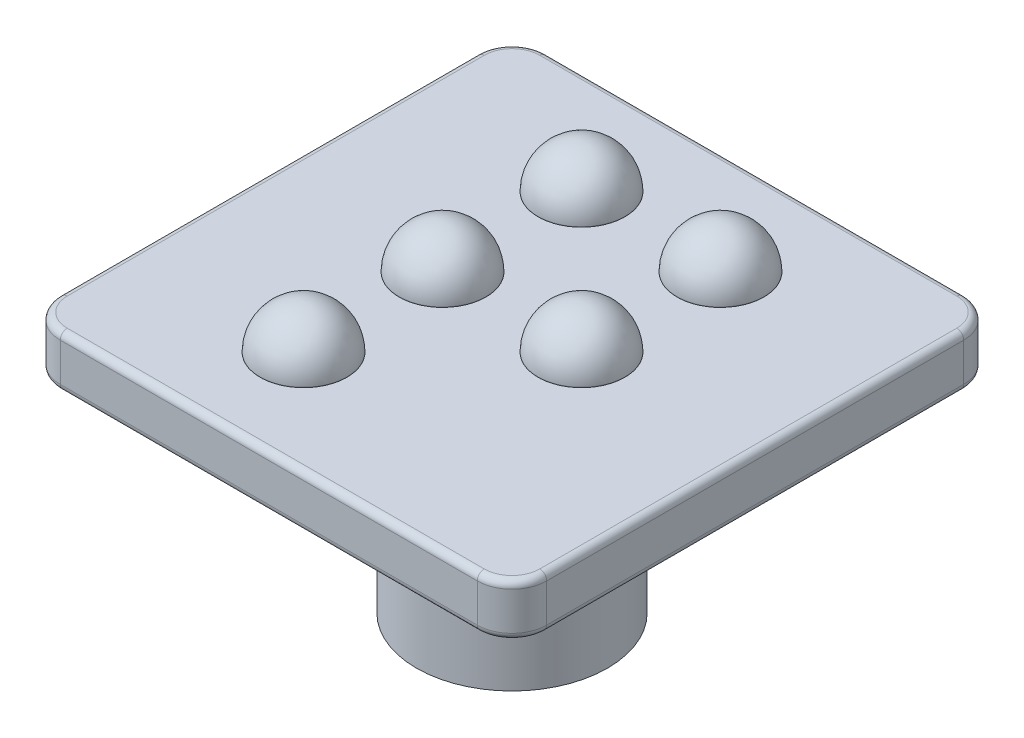
from build123d import *

# Parameters (mm, degrees)
BOSS_EXTRUDE1_DEPTH = 1.5
SKETCH2_R           = 2.75
BOSS_EXTRUDE2_DEPTH = 6
SKETCH3_W           = 1.1
SKETCH3_H           = 1.45
SKETCH3_W_2         = 1.45
SKETCH3_H_2         = 1.1
CUT_EXTRUDE1_DEPTH  = 6
CHAMFER1_SIZE       = 0.3
FILLET1_R           = 1
SKETCH4_R           = 1.25
BOSS_EXTRUDE3_DEPTH = 0.01
DOME1_FACE_RADIUS   = 1.25
DOME1_HEIGHT        = 1.25
DOME2_FACE_RADIUS   = 1.25
DOME2_HEIGHT        = 1.25
DOME3_FACE_RADIUS   = 1.25
DOME3_HEIGHT        = 1.25
DOME4_FACE_RADIUS   = 1.25
DOME4_HEIGHT        = 1.25
DOME5_FACE_RADIUS   = 1.25
DOME5_HEIGHT        = 1.25
FILLET3_R           = 0.2


with BuildPart() as part:
    # Sketch1 → Boss-Extrude1 (new body)
    with BuildSketch(Plane(origin=(0, 0, 0), x_dir=(1, 0, 0), z_dir=(0, 1, 0))):
        with BuildLine():
            Line((-7.324675649, 4.396717546), (4.675324351, 4.396717546))
            ThreePointArc((4.675324351, 4.396717546), (5.382431132, 4.103824327), (5.675324351, 3.396717546))
            Line((5.675324351, 3.396717546), (5.675324351, -8.603282454))
            ThreePointArc((5.675324351, -8.603282454), (5.382431132, -9.310389235), (4.675324351, -9.603282454))
            Line((4.675324351, -9.603282454), (-7.324675649, -9.603282454))
            ThreePointArc((-7.324675649, -9.603282454), (-8.03178243, -9.310389235), (-8.324675649, -8.603282454))
            Line((-8.324675649, -8.603282454), (-8.324675649, 3.396717546))
            ThreePointArc((-8.324675649, 3.396717546), (-8.03178243, 4.103824327), (-7.324675649, 4.396717546))
        make_face()
    extrude(amount=BOSS_EXTRUDE1_DEPTH)

    # Sketch2 → Boss-Extrude2 (add)
    with BuildSketch(Plane.XZ):
        with Locations(Location((-1.324675649, 2.603282454, 0), (0, 0, 270))):
            Circle(SKETCH2_R)
    extrude(amount=BOSS_EXTRUDE2_DEPTH)

    # Sketch3 → Cut-Extrude1 (cut)
    with BuildSketch(Plane.XZ.offset(6)):
        with Locations((-1.324675649, 3.878282454)):
            Rectangle(SKETCH3_W, SKETCH3_H)
        with Locations((-0.049675649, 2.603282454)):
            Rectangle(SKETCH3_W_2, SKETCH3_H_2)
        with Locations((-1.324675649, 2.603282454)):
            Rectangle(SKETCH3_W, SKETCH3_H_2)
        with Locations((-2.599675649, 2.603282454)):
            Rectangle(SKETCH3_W_2, SKETCH3_H_2)
        with Locations((-1.324675649, 1.328282454)):
            Rectangle(SKETCH3_W, SKETCH3_H)
    extrude(amount=-CUT_EXTRUDE1_DEPTH, mode=Mode.SUBTRACT)

    # Chamfer1
    chamfer1_edges = [part.edges().sort_by_distance(p)[0] for p in [
        (-0.774675649, -6, 3.878282454),
        (-0.049675649, -6, 3.153282454),
        (0.675324351, -6, 2.603282454),
        (-0.774675649, -6, 1.328282454),
        (-2.599675649, -6, 3.153282454),
        (-1.324675649, -6, 4.603282454),
        (-1.874675649, -6, 3.878282454),
        (-3.324675649, -6, 2.603282454),
        (-2.599675649, -6, 2.053282454),
        (-1.874675649, -6, 1.328282454),
        (-1.324675649, -6, 0.603282454),
        (-0.049675649, -6, 2.053282454),
    ]]
    chamfer(chamfer1_edges, length=CHAMFER1_SIZE)

    # Fillet1
    fillet1_edges = [part.edges().sort_by_distance(p)[0] for p in [
        (-1.324675649, 0, 5.353282454),
    ]]
    fillet(fillet1_edges, radius=FILLET1_R)

    # Sketch4 → Boss-Extrude3 (add)
    with BuildSketch(Plane(origin=(0, 1.5, 0), x_dir=(1, 0, 0), z_dir=(0, 1, 0))):
        with Locations(Location((-3.324675649, 1.396717546, 0), (0, 0, 90))):
            Circle(SKETCH4_R)
        with Locations(Location((0.675324351, -2.603282454, 0), (0, 0, 90))):
            Circle(SKETCH4_R)
        with Locations(Location((-3.324675649, -2.603282454, 0), (0, 0, 90))):
            Circle(SKETCH4_R)
        with Locations(Location((-3.324675649, -6.603282454, 0), (0, 0, 90))):
            Circle(SKETCH4_R)
        with Locations(Location((0.675324351, 1.396717546, 0), (0, 0, 90))):
            Circle(SKETCH4_R)
    extrude(amount=BOSS_EXTRUDE3_DEPTH)

    # Dome1: a dome of height H over a round flat face of radius A is a cap of a sphere of radius (A * A + H * H) / (2 * H)
    dome1_r = (DOME1_FACE_RADIUS * DOME1_FACE_RADIUS + DOME1_HEIGHT * DOME1_HEIGHT) / (2 * DOME1_HEIGHT)
    dome1_base = Plane((-3.324675649, 1.51, -1.396717546), z_dir=(0, 1, 0))
    with Locations(dome1_base.offset(DOME1_HEIGHT - dome1_r)):
        dome1_ball = Sphere(dome1_r, mode=Mode.PRIVATE)
    add(split(dome1_ball, bisect_by=dome1_base, keep=Keep.TOP, mode=Mode.PRIVATE))

    # Dome2: a dome of height H over a round flat face of radius A is a cap of a sphere of radius (A * A + H * H) / (2 * H)
    dome2_r = (DOME2_FACE_RADIUS * DOME2_FACE_RADIUS + DOME2_HEIGHT * DOME2_HEIGHT) / (2 * DOME2_HEIGHT)
    dome2_base = Plane((0.675324351, 1.51, -1.396717546), z_dir=(0, 1, 0))
    with Locations(dome2_base.offset(DOME2_HEIGHT - dome2_r)):
        dome2_ball = Sphere(dome2_r, mode=Mode.PRIVATE)
    add(split(dome2_ball, bisect_by=dome2_base, keep=Keep.TOP, mode=Mode.PRIVATE))

    # Dome3: a dome of height H over a round flat face of radius A is a cap of a sphere of radius (A * A + H * H) / (2 * H)
    dome3_r = (DOME3_FACE_RADIUS * DOME3_FACE_RADIUS + DOME3_HEIGHT * DOME3_HEIGHT) / (2 * DOME3_HEIGHT)
    dome3_base = Plane((-3.324675649, 1.51, 2.603282454), z_dir=(0, 1, 0))
    with Locations(dome3_base.offset(DOME3_HEIGHT - dome3_r)):
        dome3_ball = Sphere(dome3_r, mode=Mode.PRIVATE)
    add(split(dome3_ball, bisect_by=dome3_base, keep=Keep.TOP, mode=Mode.PRIVATE))

    # Dome4: a dome of height H over a round flat face of radius A is a cap of a sphere of radius (A * A + H * H) / (2 * H)
    dome4_r = (DOME4_FACE_RADIUS * DOME4_FACE_RADIUS + DOME4_HEIGHT * DOME4_HEIGHT) / (2 * DOME4_HEIGHT)
    dome4_base = Plane((0.675324351, 1.51, 2.603282454), z_dir=(0, 1, 0))
    with Locations(dome4_base.offset(DOME4_HEIGHT - dome4_r)):
        dome4_ball = Sphere(dome4_r, mode=Mode.PRIVATE)
    add(split(dome4_ball, bisect_by=dome4_base, keep=Keep.TOP, mode=Mode.PRIVATE))

    # Dome5: a dome of height H over a round flat face of radius A is a cap of a sphere of radius (A * A + H * H) / (2 * H)
    dome5_r = (DOME5_FACE_RADIUS * DOME5_FACE_RADIUS + DOME5_HEIGHT * DOME5_HEIGHT) / (2 * DOME5_HEIGHT)
    dome5_base = Plane((-3.324675649, 1.51, 6.603282454), z_dir=(0, 1, 0))
    with Locations(dome5_base.offset(DOME5_HEIGHT - dome5_r)):
        dome5_ball = Sphere(dome5_r, mode=Mode.PRIVATE)
    add(split(dome5_ball, bisect_by=dome5_base, keep=Keep.TOP, mode=Mode.PRIVATE))

    # Fillet3
    fillet3_edges = [part.edges().sort_by_distance(p)[0] for p in [
        (5.382431132, 1.5, 9.310389235),
        (-1.324675649, 0, 9.603282454),
        (-8.03178243, 0, 9.310389235),
        (5.675324351, 1.5, 2.603282454),
        (5.382431132, 1.5, -4.103824327),
        (-1.324675649, 1.5, -4.396717546),
        (-8.03178243, 1.5, -4.103824327),
        (-8.324675649, 1.5, 2.603282454),
        (-8.03178243, 1.5, 9.310389235),
        (-1.324675649, 1.5, 9.603282454),
        (-8.324675649, 0, 2.603282454),
        (-8.03178243, 0, -4.103824327),
        (-1.324675649, 0, -4.396717546),
        (5.382431132, 0, -4.103824327),
        (5.675324351, 0, 2.603282454),
        (5.382431132, 0, 9.310389235),
    ]]
    fillet(fillet3_edges, radius=FILLET3_R)


solid = part.part
